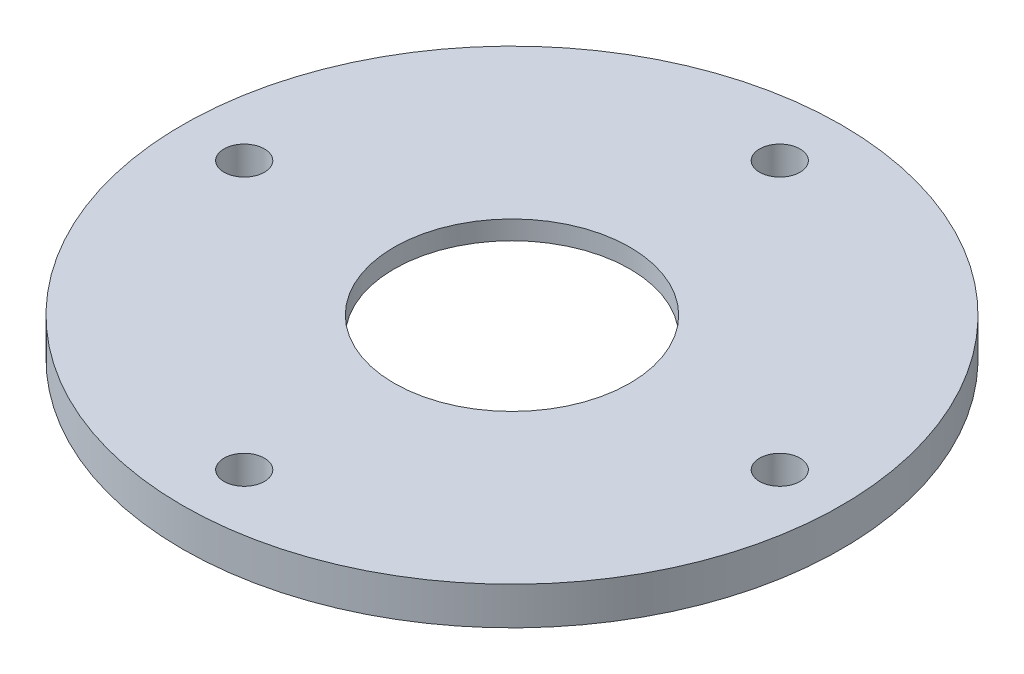
from build123d import *

# Parameters (mm, degrees)
M3_CLEARANCE_HOLE1_D = 3.4


with BuildPart() as part:
    # Sketch1 → Revolve1 (revolve)
    with BuildSketch(Plane.XY, mode=Mode.PRIVATE) as revolve1_sk:
        Polygon((12.3063, 0), (12.3063, 1.5875), (9.906, 1.5875), (9.906, 3.175), (27.69, 3.175), (27.69, 0), align=None)
    revolve(revolve1_sk.sketch.rotate(Axis((0, 0, 0), (0, 1, 0)), 90), axis=Axis((0, 0, 0), (0, 1, 0)))

    # M3 Clearance Hole1 (through all)
    with Locations(Plane(origin=(0, 3.175, 0), x_dir=(1, 0, 0), z_dir=(0, 1, 0))):
        with Locations((22.5, 0), (0, 22.5), (-22.5, 0), (0, -22.5)):
            Hole(M3_CLEARANCE_HOLE1_D / 2)


solid = part.part
